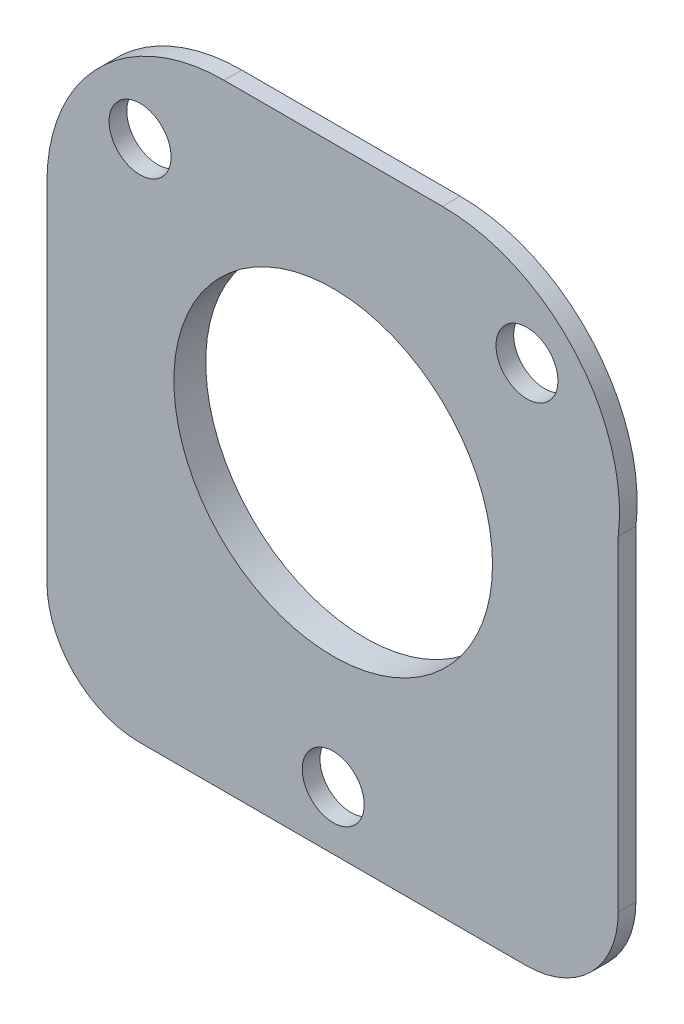
from build123d import *

# Parameters (mm, degrees)
SCHIZZO1_R                   = 1.75
SCHIZZO1_R_2                 = 12.1
ESTRUSIONE_ESTRUSIONE1_DEPTH = 1
ESTRUSIONE_ESTRUSIONE2_START = -1.8
SCHIZZO2_R                   = 12.1
SCHIZZO2_R_2                 = 9
ESTRUSIONE_ESTRUSIONE2_DEPTH = 1.8


with BuildPart() as part:
    # Schizzo1 → Estrusione-Estrusione1 (new body)
    with BuildSketch(Plane.XY):
        with BuildLine():
            Line((-10.957517396, -18.677002221), (10.886206072, -18.677002221))
            ThreePointArc((10.886206072, -18.677002221), (14.572915114, -17.149917336), (16.1, -13.463208293))
            Line((16.1, -13.463208293), (16.1, 4.907883736))
            ThreePointArc((16.1, 4.907883736), (13.651991863, 12.73622021), (6.171311325, 16.1))
            Line((6.171311325, 16.1), (-6.171311325, 16.1))
            ThreePointArc((-6.171311325, 16.1), (-13.242379137, 13.171067812), (-16.171311325, 6.1))
            Line((-16.171311325, 6.1), (-16.171311325, -13.463208293))
            ThreePointArc((-16.171311325, -13.463208293), (-14.644226439, -17.149917336), (-10.957517396, -18.677002221))
        make_face()
        with Locations((0, -15.38859776)):
            Circle(SCHIZZO1_R, mode=Mode.SUBTRACT)
        with Locations((10.944459062, 10.817992606)):
            Circle(SCHIZZO1_R, mode=Mode.SUBTRACT)
        with Locations((-10.910719744, 10.851964601)):
            Circle(SCHIZZO1_R, mode=Mode.SUBTRACT)
        Circle(SCHIZZO1_R_2, mode=Mode.SUBTRACT)
    extrude(amount=ESTRUSIONE_ESTRUSIONE1_DEPTH)

    # Schizzo2 → Estrusione-Estrusione2 (add)
    with BuildSketch(Plane.XY.offset(1).offset(ESTRUSIONE_ESTRUSIONE2_START)):
        Circle(SCHIZZO2_R)
        Circle(SCHIZZO2_R_2, mode=Mode.SUBTRACT)
    extrude(amount=ESTRUSIONE_ESTRUSIONE2_DEPTH)


solid = part.part
